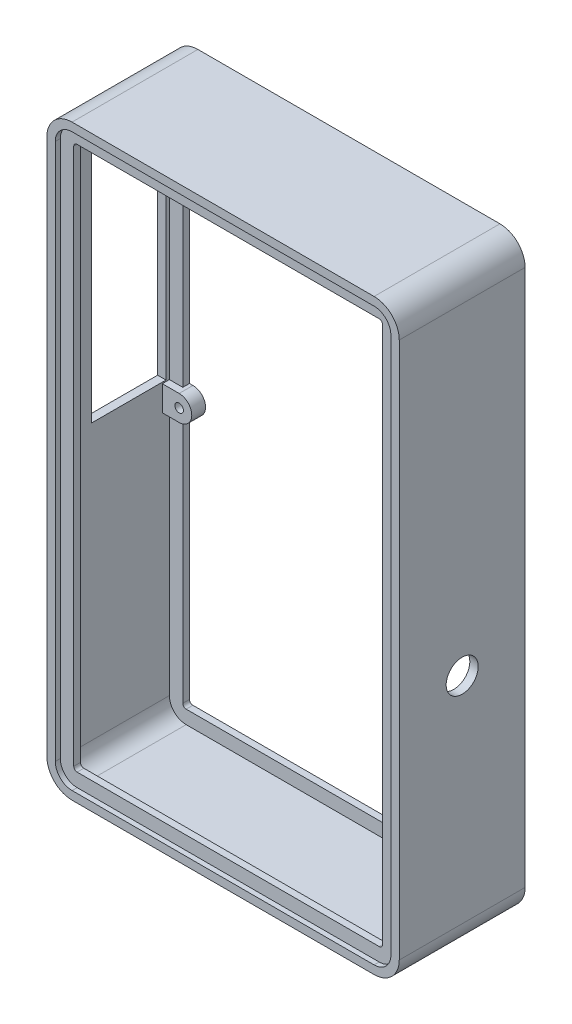
from build123d import *

# Parameters (mm, degrees)
SKETCH1_W               = 210
SKETCH1_H               = 350
SKETCH1_W_2             = 200
SKETCH1_H_2             = 340
BOSS_EXTRUDE1_DEPTH     = 75
FILLET1_R               = 15
FILLET2_R               = 10
BOSS_EXTRUDE2_START     = -4
BOSS_EXTRUDE2_DEPTH     = 4
CUT_EXTRUDE1_DEPTH      = 4
CUT_EXTRUDE1_DEPTH_BACK = 25
SKETCH3_W               = 44.5
SKETCH3_H               = 156.13
SKETCH3_H_2             = 2.62
SKETCH4_W               = 2
SKETCH4_H               = 2.62
CUT_EXTRUDE2_DEPTH      = 18
BOSS_EXTRUDE4_START     = -4
SKETCH5_R               = 2.55
BOSS_EXTRUDE4_DEPTH     = 8.23
SKETCH6_R               = 9.55
CUT_EXTRUDE4_DEPTH      = 22
CUT_EXTRUDE5_START      = -22
CUT_EXTRUDE5_DEPTH      = 22


with BuildPart() as part:
    # Sketch1 → Boss-Extrude1 (new body)
    with BuildSketch(Plane.XY):
        with Locations((105, 175)):
            Rectangle(SKETCH1_W, SKETCH1_H)
        with Locations((105, 175)):
            Rectangle(SKETCH1_W_2, SKETCH1_H_2, mode=Mode.SUBTRACT)
    extrude(amount=BOSS_EXTRUDE1_DEPTH)

    # Fillet1
    fillet1_edges = [part.edges().sort_by_distance(p)[0] for p in [
        (0, 350, 37.5),
        (210, 350, 37.5),
        (210, 0, 37.5),
        (0, 0, 37.5),
    ]]
    fillet(fillet1_edges, radius=FILLET1_R)

    # Fillet2
    fillet2_edges = [part.edges().sort_by_distance(p)[0] for p in [
        (5, 5, 37.5),
        (205, 5, 37.5),
        (205, 345, 37.5),
        (5, 345, 37.5),
    ]]
    fillet(fillet2_edges, radius=FILLET2_R)

    # Sketch2 → Boss-Extrude2 (add)
    with BuildSketch(Plane(origin=(0, 0, 3), x_dir=(-1, 0, 0), z_dir=(0, 0, -1)).offset(BOSS_EXTRUDE2_START)):
        with BuildLine():
            Line((-15, 5), (-195, 5))
            ThreePointArc((-195, 5), (-202.071067812, 7.928932188), (-205, 15))
            Line((-205, 15), (-205, 335))
            ThreePointArc((-205, 335), (-202.071067812, 342.071067812), (-195, 345))
            Line((-195, 345), (-15, 345))
            ThreePointArc((-15, 345), (-7.928932188, 342.071067812), (-5, 335))
            Line((-5, 335), (-5, 15))
            ThreePointArc((-5, 15), (-7.928932188, 7.928932188), (-15, 5))
        make_face()
        with BuildLine():
            Line((-13, 335), (-13, 15))
            ThreePointArc((-13, 15), (-13.585786438, 13.585786438), (-15, 13))
            Line((-15, 13), (-195, 13))
            ThreePointArc((-195, 13), (-196.414213562, 13.585786438), (-197, 15))
            Line((-197, 15), (-197, 335))
            ThreePointArc((-197, 335), (-196.414213562, 336.414213562), (-195, 337))
            Line((-195, 337), (-15, 337))
            ThreePointArc((-15, 337), (-13.585786438, 336.414213562), (-13, 335))
        make_face(mode=Mode.SUBTRACT)
    boss_extrude2 = extrude(amount=BOSS_EXTRUDE2_DEPTH)

    # Mirror1: Boss-Extrude2 across plane
    add(boss_extrude2.mirror(Plane(origin=(0, 0, 37.5), x_dir=(1, 0, 0), z_dir=(0, 0, -1))))

    # Sketch3 → Cut-Extrude1 (cut, two sides: drawn at the far end of the back side and taken through both)
    with BuildSketch(Plane(origin=(5, 0, 0), x_dir=(0, 0, -1), z_dir=(1, 0, 0)).offset(-CUT_EXTRUDE1_DEPTH_BACK)):
        with Locations((-31.25, 256.935)):
            Rectangle(SKETCH3_W, SKETCH3_H)
        with Locations((-31.25, 336.31)):
            Rectangle(SKETCH3_W, SKETCH3_H_2)
    extrude(amount=CUT_EXTRUDE1_DEPTH + CUT_EXTRUDE1_DEPTH_BACK, mode=Mode.SUBTRACT)

    # Sketch4 → Cut-Extrude2 (cut)
    with BuildSketch(Plane(origin=(5, 0, 0), x_dir=(0, 0, -1), z_dir=(1, 0, 0))):
        with Locations((-54.5, 336.31)):
            Rectangle(SKETCH4_W, SKETCH4_H)
        Polygon((-9, 337.62), (-53.5, 337.62), (-55.5, 337.62), (-55.5, 339.62), (-7, 339.62), (-7, 337.62), align=None)
        with Locations((-8, 336.31)):
            Rectangle(SKETCH4_W, SKETCH4_H)
    extrude(amount=CUT_EXTRUDE2_DEPTH, mode=Mode.SUBTRACT)

    # Sketch5 → Boss-Extrude4 (add)
    # profile 1 of 4: a face of its own
    with BuildSketch(Plane.XY.offset(7).offset(BOSS_EXTRUDE4_START)):
        with BuildLine():
            Line((15.06, 178.09), (5, 178.09))
            Line((5, 178.09), (5, 163.09))
            Line((5, 163.09), (15.06, 163.09))
            ThreePointArc((15.06, 163.09), (20.363300859, 165.286699141), (22.56, 170.59))
            ThreePointArc((22.56, 170.59), (20.363300859, 175.893300859), (15.06, 178.09))
        make_face()
        with Locations((15.06, 170.59)):
            Circle(SKETCH5_R, mode=Mode.SUBTRACT)
    # profile 2 of 4: a face of its own
    with BuildSketch(Plane.XY.offset(7).offset(BOSS_EXTRUDE4_START)):
        with BuildLine():
            Line((205, 163.09), (205, 178.09))
            Line((205, 178.09), (170, 178.09))
            ThreePointArc((170, 178.09), (164.696699141, 175.893300859), (162.5, 170.59))
            ThreePointArc((162.5, 170.59), (164.696699141, 165.286699141), (170, 163.09))
            Line((170, 163.09), (205, 163.09))
        make_face()
        with Locations((170, 170.59)):
            Circle(SKETCH5_R, mode=Mode.SUBTRACT)
    # profile 3 of 4: a face of its own
    with BuildSketch(Plane.XY.offset(7).offset(BOSS_EXTRUDE4_START)):
        with BuildLine():
            Line((195, 345), (162.5, 345))
            Line((162.5, 345), (162.5, 328.07))
            ThreePointArc((162.5, 328.07), (164.696699141, 322.766699141), (170, 320.57))
            Line((170, 320.57), (205, 320.57))
            Line((205, 320.57), (205, 335))
            ThreePointArc((205, 335), (202.071067812, 342.071067812), (195, 345))
        make_face()
        with Locations(Location((170, 328.07, 0), (0, 0, 180))):
            Circle(SKETCH5_R, mode=Mode.SUBTRACT)
    # profile 4 of 4: a face of its own
    with BuildSketch(Plane.XY.offset(7).offset(BOSS_EXTRUDE4_START)):
        with BuildLine():
            Line((45.42, 345), (30.42, 345))
            Line((30.42, 345), (30.42, 328.07))
            ThreePointArc((30.42, 328.07), (37.92, 320.57), (45.42, 328.07))
            Line((45.42, 328.07), (45.42, 345))
        make_face()
        with Locations((37.92, 328.07)):
            Circle(SKETCH5_R, mode=Mode.SUBTRACT)
    extrude(amount=BOSS_EXTRUDE4_DEPTH)

    # Sketch6 → Cut-Extrude4 (cut)
    with BuildSketch(Plane(origin=(210, 0, 0), x_dir=(0, 0, -1), z_dir=(1, 0, 0))):
        with Locations((-37.5, 143)):
            Circle(SKETCH6_R)
    extrude(amount=-CUT_EXTRUDE4_DEPTH, mode=Mode.SUBTRACT)

    # Sketch7 → Cut-Extrude5 (cut)
    with BuildSketch(Plane.XY.offset(11.23).offset(CUT_EXTRUDE5_START)):
        with BuildLine():
            Line((13, 169.087036261), (13, 172.092963739))
            ThreePointArc((13, 172.092963739), (12.51, 170.59), (13, 169.087036261))
        make_face()
    extrude(amount=CUT_EXTRUDE5_DEPTH, mode=Mode.SUBTRACT)


solid = part.part
